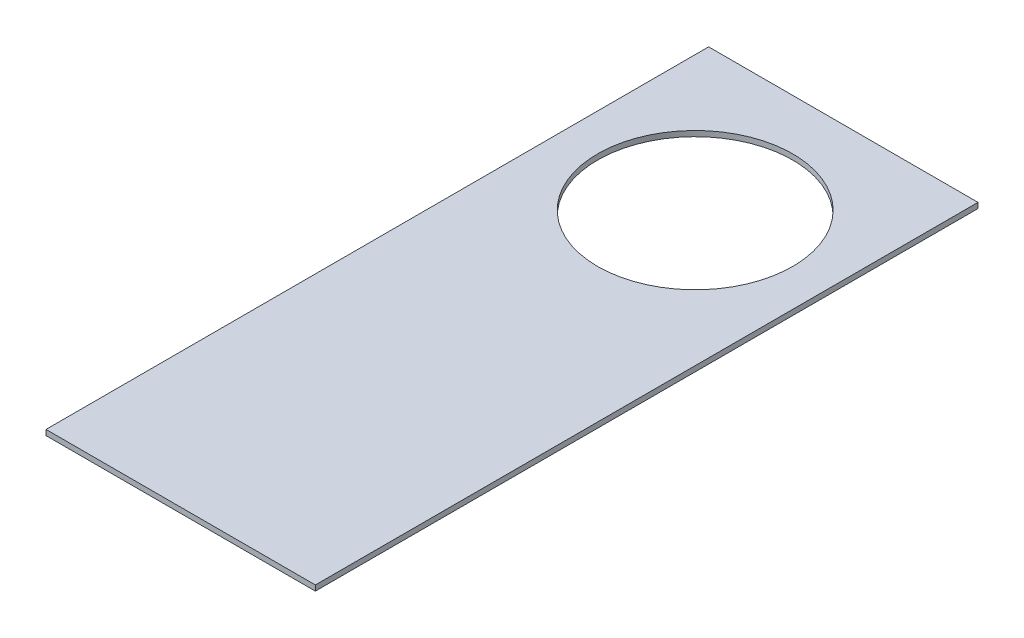
from build123d import *

# Parameters (mm, degrees)
SKETCH1_W           = 158.75
SKETCH1_H           = 390.525
BOSS_EXTRUDE1_DEPTH = 3.175
SKETCH4_R           = 57.5
CUT_EXTRUDE1_DEPTH  = 422.570182473


with BuildPart() as part:
    # Sketch1 → Boss-Extrude1 (new body)
    with BuildSketch(Plane(origin=(0, 0, 0), x_dir=(1, 0, 0), z_dir=(0, 1, 0))):
        with Locations((79.375, 195.2625)):
            Rectangle(SKETCH1_W, SKETCH1_H)
    extrude(amount=BOSS_EXTRUDE1_DEPTH)

    # Sketch4 → Cut-Extrude1 (cut, through all)
    with BuildSketch(Plane(origin=(0, 3.175, 0), x_dir=(1, 0, 0), z_dir=(0, 1, 0))):
        with Locations(Location((79.375, 303.2125, 0), (0, 0, 270))):
            Circle(SKETCH4_R)
    extrude(amount=-CUT_EXTRUDE1_DEPTH, mode=Mode.SUBTRACT)


solid = part.part
